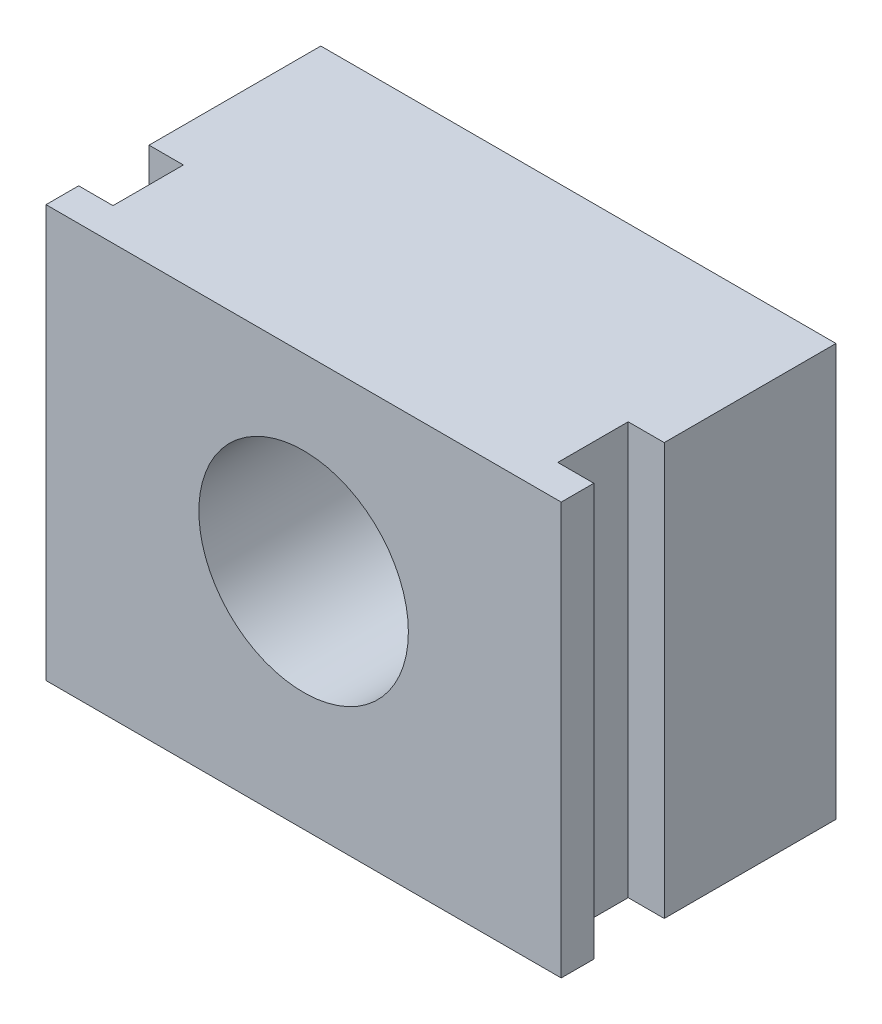
from build123d import *

# Parameters (mm, degrees)
ESQUISSE1_W             = 15
ESQUISSE1_H             = 12
BOSS_EXTRU_1_DEPTH      = 5
ESQUISSE2_W             = 12.95
ESQUISSE2_H             = 12
BOSS_EXTRU_2_DEPTH      = 2.05
ESQUISSE3_W             = 15
ESQUISSE3_H             = 12
BOSS_EXTRU_3_DEPTH      = 0.95
ESQUISSE4_R             = 3.05
ENL_V_MAT_EXTRU_1_DEPTH = 8


with BuildPart() as part:
    # Esquisse1 → Boss.-Extru.1 (new body)
    with BuildSketch(Plane.XY):
        Rectangle(ESQUISSE1_W, ESQUISSE1_H)
    extrude(amount=BOSS_EXTRU_1_DEPTH)

    # Esquisse2 → Boss.-Extru.2 (add)
    with BuildSketch(Plane.XY.offset(5)):
        with Locations((-0.025, 0)):
            Rectangle(ESQUISSE2_W, ESQUISSE2_H)
    extrude(amount=BOSS_EXTRU_2_DEPTH)

    # Esquisse3 → Boss.-Extru.3 (add)
    with BuildSketch(Plane.XY.offset(7.05)):
        Rectangle(ESQUISSE3_W, ESQUISSE3_H)
    extrude(amount=BOSS_EXTRU_3_DEPTH)

    # Esquisse4 → Enlèv. mat.-Extru.1 (cut)
    with BuildSketch(Plane.XY.offset(8)):
        with Locations((0, 0.5)):
            Circle(ESQUISSE4_R)
    extrude(amount=-ENL_V_MAT_EXTRU_1_DEPTH, mode=Mode.SUBTRACT)


solid = part.part
